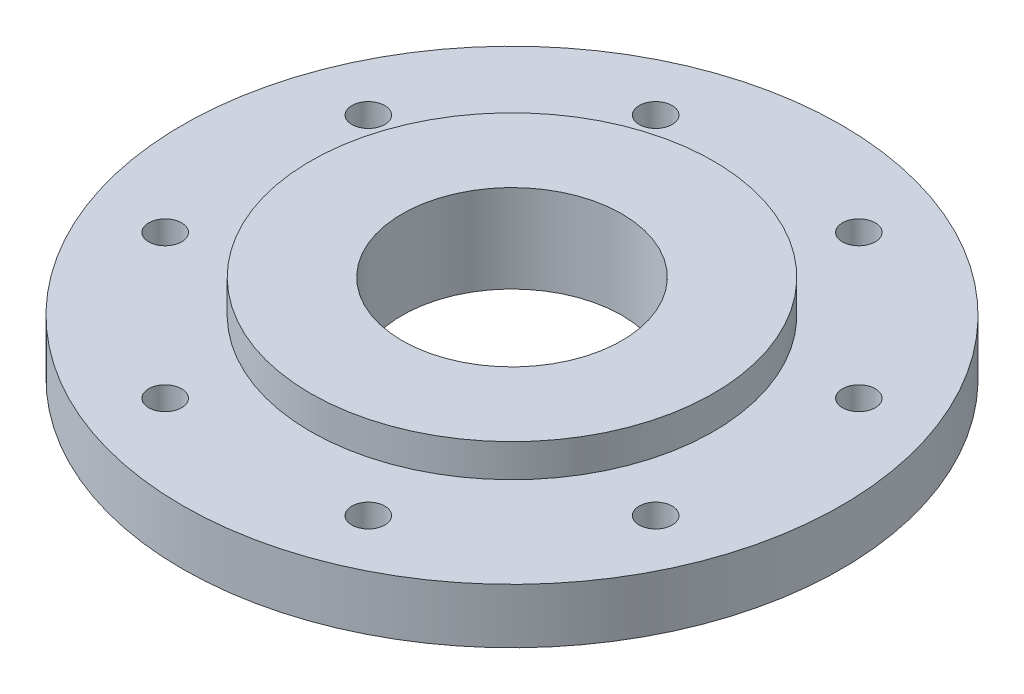
from build123d import *

# Parameters (mm, degrees)
F_01_FLANGE_PROFILE_R     = 180
F_01_FLANGE_PROFILE_R_2   = 60
F_01_FLANGE_PROFILE_R_3   = 9
F_01_FLANGE_EXTRUDE_DEPTH = 30
F_02_HUB_PROFILE_R        = 110
F_02_HUB_PROFILE_R_2      = 60
F_02_LOCATING_HUB_DEPTH   = 48


with BuildPart() as part:
    # 01_Flange_Profile → 01_Flange_Extrude (new body)
    with BuildSketch(Plane(origin=(0, 0, 0), x_dir=(1, 0, 0), z_dir=(0, 1, 0))):
        with Locations(Location((0, 0, 0), (0, 0, 270))):
            Circle(F_01_FLANGE_PROFILE_R)
        with Locations(Location((0, 0, 0), (0, 0, 270))):
            Circle(F_01_FLANGE_PROFILE_R_2, mode=Mode.SUBTRACT)
        with Locations(Location((133.962532214, 55.489097693, 0), (0, 0, 270))):
            Circle(F_01_FLANGE_PROFILE_R_3, mode=Mode.SUBTRACT)
        with Locations(Location((55.489097693, 133.962532214, 0), (0, 0, 270))):
            Circle(F_01_FLANGE_PROFILE_R_3, mode=Mode.SUBTRACT)
        with Locations(Location((-55.489097693, 133.962532214, 0), (0, 0, 270))):
            Circle(F_01_FLANGE_PROFILE_R_3, mode=Mode.SUBTRACT)
        with Locations(Location((-133.962532214, 55.489097693, 0), (0, 0, 270))):
            Circle(F_01_FLANGE_PROFILE_R_3, mode=Mode.SUBTRACT)
        with Locations(Location((-133.962532214, -55.489097693, 0), (0, 0, 270))):
            Circle(F_01_FLANGE_PROFILE_R_3, mode=Mode.SUBTRACT)
        with Locations(Location((-55.489097693, -133.962532214, 0), (0, 0, 270))):
            Circle(F_01_FLANGE_PROFILE_R_3, mode=Mode.SUBTRACT)
        with Locations(Location((55.489097693, -133.962532214, 0), (0, 0, 270))):
            Circle(F_01_FLANGE_PROFILE_R_3, mode=Mode.SUBTRACT)
        with Locations(Location((133.962532214, -55.489097693, 0), (0, 0, 270))):
            Circle(F_01_FLANGE_PROFILE_R_3, mode=Mode.SUBTRACT)
    extrude(amount=F_01_FLANGE_EXTRUDE_DEPTH)

    # 02_Hub_Profile → 02_Locating_Hub (add)
    with BuildSketch(Plane(origin=(0, 0, 0), x_dir=(1, 0, 0), z_dir=(0, 1, 0))):
        with Locations(Location((0, 0, 0), (0, 0, 270))):
            Circle(F_02_HUB_PROFILE_R)
        with Locations(Location((0, 0, 0), (0, 0, 270))):
            Circle(F_02_HUB_PROFILE_R_2, mode=Mode.SUBTRACT)
    extrude(amount=F_02_LOCATING_HUB_DEPTH)


solid = part.part
